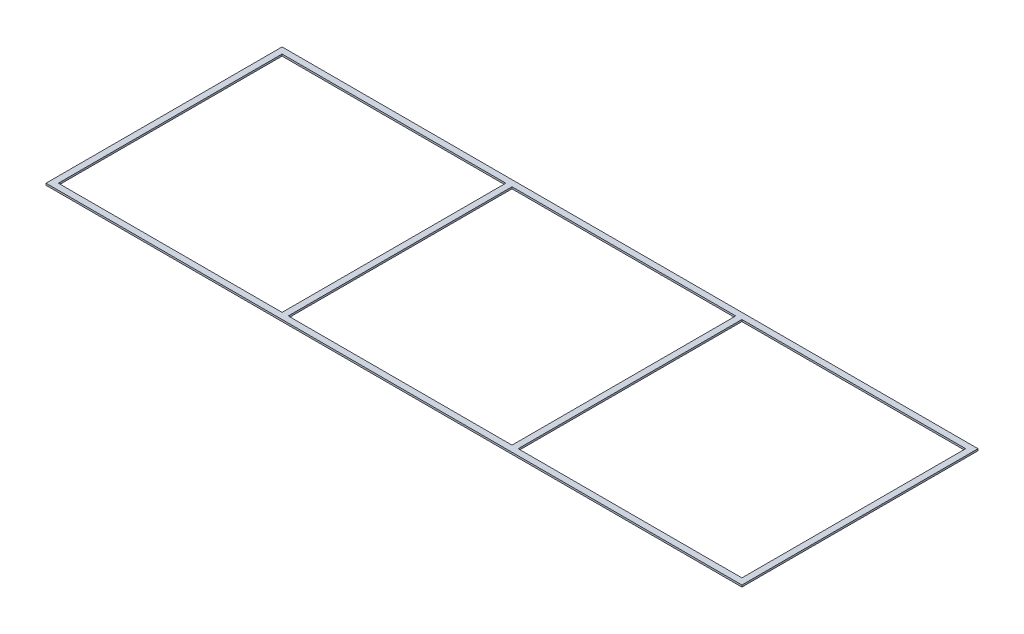
from build123d import *

# Parameters (mm, degrees)
SKETCH1_W         = 13.56
SKETCH1_H         = 4.6
BASE_DEPTH        = 0.036
SKETCH2_W         = 4.36
SKETCH2_H         = 4.36
CUTOUT_BASE_DEPTH = 0.036


with BuildPart() as part:
    # Sketch1 → Base (new body)
    with BuildSketch(Plane(origin=(0, 0, 0), x_dir=(1, 0, 0), z_dir=(0, 1, 0))):
        Rectangle(SKETCH1_W, SKETCH1_H)
    extrude(amount=-BASE_DEPTH)

    # Sketch2 → Cutout Base (cut)
    with BuildSketch(Plane(origin=(0, 0, 0), x_dir=(1, 0, 0), z_dir=(0, 1, 0))):
        Rectangle(SKETCH2_W, SKETCH2_H)
        with Locations((-4.48, 0)):
            Rectangle(SKETCH2_W, SKETCH2_H)
        with Locations((4.48, 0)):
            Rectangle(SKETCH2_W, SKETCH2_H)
    extrude(amount=-CUTOUT_BASE_DEPTH, mode=Mode.SUBTRACT)


solid = part.part
